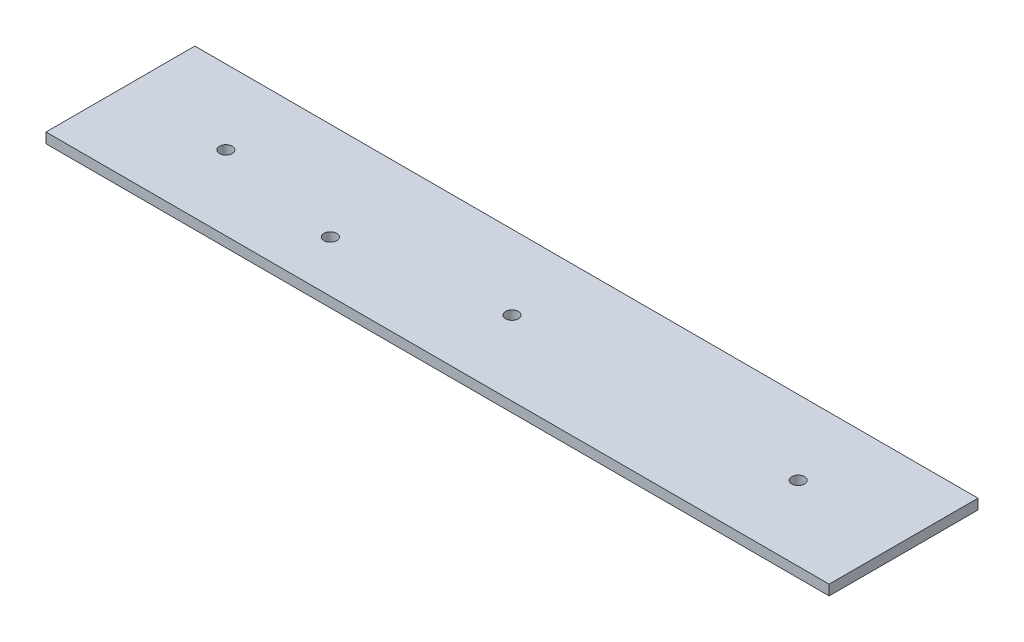
from build123d import *

# Parameters (mm, degrees)
SKETCH1_W           = 194.300874916
SKETCH1_H           = 36.931173376
SKETCH1_R           = 1.5875
BOSS_EXTRUDE1_DEPTH = 1.27


with BuildPart() as part:
    # Sketch1 → Boss-Extrude1 (new, symmetric)
    with BuildSketch(Plane(origin=(0, 0, 0), x_dir=(1, 0, 0), z_dir=(0, 1, 0))):
        Rectangle(SKETCH1_W, SKETCH1_H)
        with Locations(Location((-71, 0, 0), (0, 0, 270))):
            Circle(SKETCH1_R, mode=Mode.SUBTRACT)
        with Locations(Location((71, 0, 0), (0, 0, 270))):
            Circle(SKETCH1_R, mode=Mode.SUBTRACT)
        with Locations(Location((0, 0, 0), (0, 0, 270))):
            Circle(SKETCH1_R, mode=Mode.SUBTRACT)
        with Locations(Location((-39.31, -5.75, 0), (0, 0, 270))):
            Circle(SKETCH1_R, mode=Mode.SUBTRACT)
    extrude(amount=BOSS_EXTRUDE1_DEPTH, both=True)


solid = part.part
